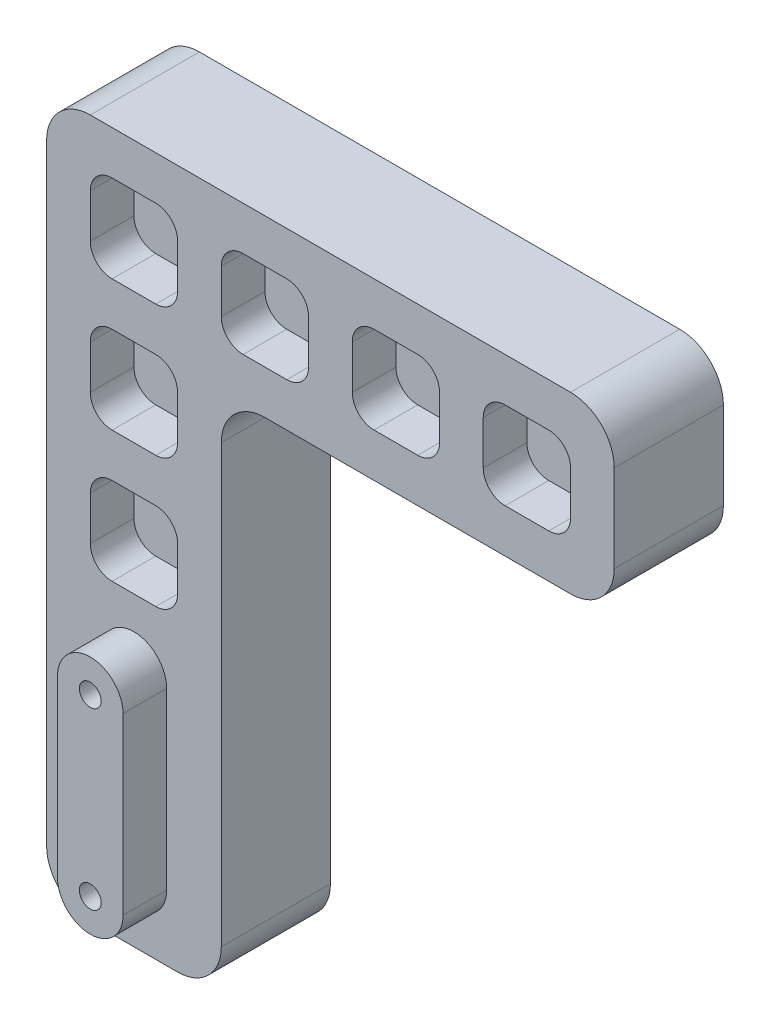
from build123d import *

# Parameters (mm, degrees)
BASE_EXTRUDE_DEPTH       = 25
SQUARE_CUT_DEPTH         = 10
HORIZONTAL_PATTERN_COUNT = 4
HORIZONTAL_PATTERN_PITCH = 30
VERTICAL_PATTERN_COUNT   = 3
VERTICAL_PATTERN_PITCH   = 30
SLOT_EXTRUDE_DEPTH       = 10
M6X1_0_SLOT_HOLES_D      = 5
EDGE_FILLETS_R           = 10


with BuildPart() as part:
    # Base Sketch → Base Extrude (new body)
    with BuildSketch(Plane.XY):
        Polygon((0, 0), (0, 160), (130, 160), (130, 120), (40, 120), (40, 0), align=None)
    extrude(amount=BASE_EXTRUDE_DEPTH)

    # Square Sketch → Square Cut (cut)
    with BuildSketch(Plane.XY.offset(25)):
        with BuildLine():
            Line((15, 150), (25, 150))
            ThreePointArc((25, 150), (28.535533906, 148.535533906), (30, 145))
            Line((30, 145), (30, 135))
            ThreePointArc((30, 135), (28.535533906, 131.464466094), (25, 130))
            Line((25, 130), (15, 130))
            ThreePointArc((15, 130), (11.464466094, 131.464466094), (10, 135))
            Line((10, 135), (10, 145))
            ThreePointArc((10, 145), (11.464466094, 148.535533906), (15, 150))
        make_face()
    square_cut = extrude(amount=-SQUARE_CUT_DEPTH, mode=Mode.SUBTRACT)

    # Horizontal Pattern: Square Cut ×4
    with Locations(*[(i * HORIZONTAL_PATTERN_PITCH, 0, 0) for i in range(1, HORIZONTAL_PATTERN_COUNT)]):
        add(square_cut, mode=Mode.SUBTRACT)

    # Vertical Pattern: Square Cut ×3
    with Locations(*[(0, -i * VERTICAL_PATTERN_PITCH, 0) for i in range(1, VERTICAL_PATTERN_COUNT)]):
        add(square_cut, mode=Mode.SUBTRACT)

    # Slot Sketch → Slot Extrude (add)
    with BuildSketch(Plane.XY.offset(25)):
        with BuildLine():
            Line((12.5, 15), (12.5, 55))
            ThreePointArc((12.5, 55), (20, 62.5), (27.5, 55))
            Line((27.5, 55), (27.5, 15))
            ThreePointArc((27.5, 15), (20, 7.5), (12.5, 15))
        make_face()
    extrude(amount=SLOT_EXTRUDE_DEPTH)

    # M6x1.0 Slot Holes (through all)
    with Locations(Plane.XY.offset(35)):
        with Locations((20, 55), (20, 15)):
            Hole(M6X1_0_SLOT_HOLES_D / 2)

    # Edge Fillets
    edge_fillets_edges = [part.edges().sort_by_distance(p)[0] for p in [
        (0, 0, 12.5),
        (0, 160, 12.5),
        (130, 160, 12.5),
        (130, 120, 12.5),
        (40, 120, 12.5),
        (40, 0, 12.5),
    ]]
    fillet(edge_fillets_edges, radius=EDGE_FILLETS_R)


solid = part.part
